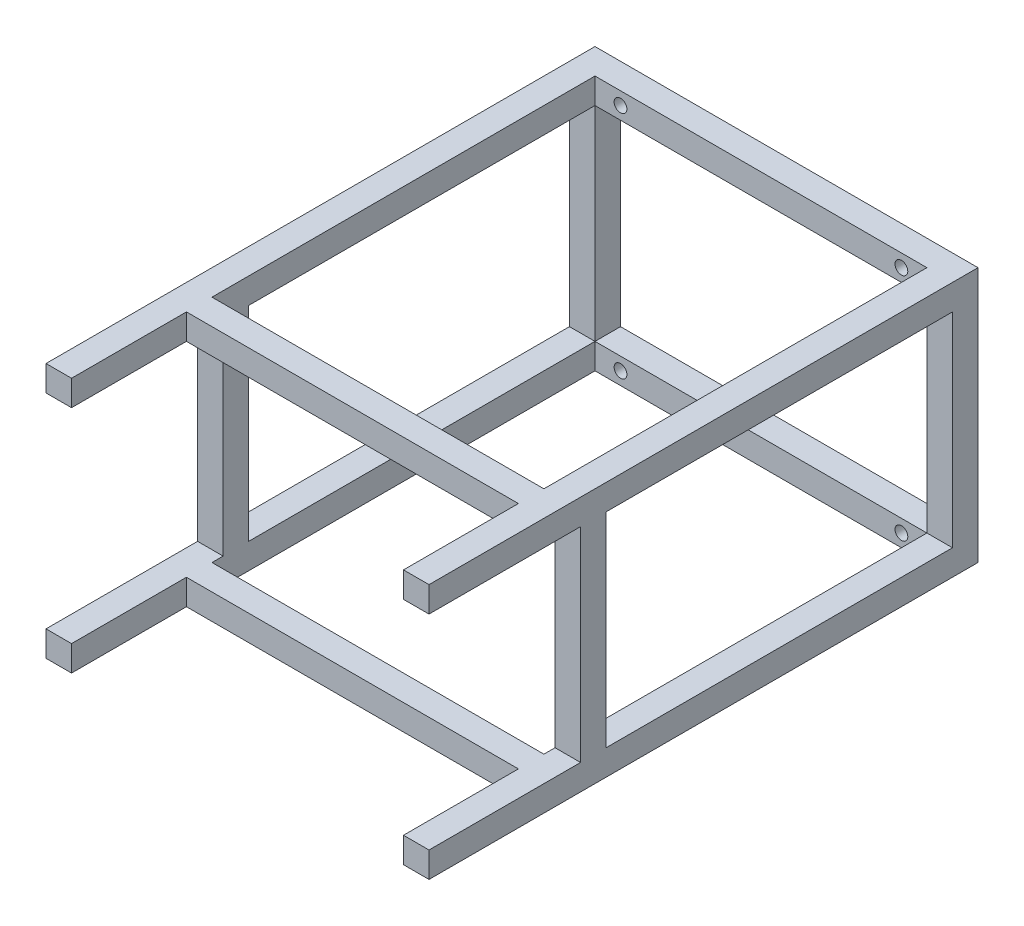
from build123d import *

# Parameters (mm, degrees)
SKETCH_1_W          = 20
SKETCH_1_H          = 20
EXTRUDE_1_DEPTH     = 430
EXTRUDE_1_2_DEPTH   = 430
EXTRUDE_1_3_DEPTH   = 430
EXTRUDE_1_4_DEPTH   = 430
SKETCH_2_W          = 20
SKETCH_2_H          = 20
EXTRUDE_2_DEPTH     = 260
SKETCH_3_W          = 20
SKETCH_3_H          = 20
EXTRUDE_3_DEPTH     = 160
SKETCH_5_W          = 20
SKETCH_5_H          = 20
EXTRUDE_4_DEPTH     = 261
SKETCH_6_W          = 20
SKETCH_6_H          = 20
EXTRUDE_6_DEPTH     = 160
SKETCH_7_R          = 5
CUT_EXTRUDE_2_DEPTH = 41


with BuildPart() as part:
    # 草图1 → 凸台-拉伸1 (new body)
    with BuildSketch(Plane.XY):
        with Locations((-140, 90)):
            Rectangle(SKETCH_1_W, SKETCH_1_H)
    extrude(amount=EXTRUDE_1_DEPTH)



with BuildPart() as body_2:
    # 草图1 → Extrude 1 2 (new body)
    with BuildSketch(Plane.XY):
        with Locations((-140, -90)):
            Rectangle(SKETCH_1_W, SKETCH_1_H)
    extrude(amount=EXTRUDE_1_2_DEPTH)


with BuildPart() as body_3:
    # 草图1 → Extrude 1 3 (new body)
    with BuildSketch(Plane.XY):
        with Locations((140, -90)):
            Rectangle(SKETCH_1_W, SKETCH_1_H)
    extrude(amount=EXTRUDE_1_3_DEPTH)


with BuildPart() as body_4:
    # 草图1 → Extrude 1 4 (new body)
    with BuildSketch(Plane.XY):
        with Locations((140, 90)):
            Rectangle(SKETCH_1_W, SKETCH_1_H)
    extrude(amount=EXTRUDE_1_4_DEPTH)


with BuildPart() as part_1:
    add(part.part)

    add(body_2.part)  # 凸台-拉伸2 merges body 2

    add(body_3.part)  # 凸台-拉伸2 merges body 3

    add(body_4.part)  # 凸台-拉伸2 merges body 4
    # 草图2 → 凸台-拉伸2 (add)
    with BuildSketch(Plane(origin=(-130, 0, 0), x_dir=(0, 0, -1), z_dir=(1, 0, 0))):
        with Locations((-10, 90)):
            Rectangle(SKETCH_2_W, SKETCH_2_H)
        with Locations((-10, -90)):
            Rectangle(SKETCH_2_W, SKETCH_2_H)
    extrude(amount=EXTRUDE_2_DEPTH)

    # 草图3 → 凸台-拉伸3 (add)
    with BuildSketch(Plane(origin=(0, -80, 0), x_dir=(1, 0, 0), z_dir=(0, 1, 0))):
        with Locations((140, -10)):
            Rectangle(SKETCH_3_W, SKETCH_3_H)
        with Locations((-140, -10)):
            Rectangle(SKETCH_3_W, SKETCH_3_H)
    extrude(amount=EXTRUDE_3_DEPTH)

    # 草图5 → 凸台-拉伸4 (add)
    with BuildSketch(Plane(origin=(-130, 0, 0), x_dir=(0, 0, -1), z_dir=(1, 0, 0))):
        with Locations((-330, 90)):
            Rectangle(SKETCH_5_W, SKETCH_5_H)
        with Locations((-330, -90)):
            Rectangle(SKETCH_5_W, SKETCH_5_H)
    extrude(amount=EXTRUDE_4_DEPTH)

    # 草图6 → 凸台-拉伸6 (add)
    with BuildSketch(Plane.XZ.offset(-80)):
        with Locations((140, 301.284847627)):
            Rectangle(SKETCH_6_W, SKETCH_6_H)
        with Locations((-140, 301.284847627)):
            Rectangle(SKETCH_6_W, SKETCH_6_H)
    extrude(amount=EXTRUDE_6_DEPTH)

    # 草图7 → 切除-拉伸2 (cut)
    with BuildSketch(Plane.XY.offset(20)):
        with Locations((110, 90)):
            Circle(SKETCH_7_R)
        with Locations((110, -90)):
            Circle(SKETCH_7_R)
        with Locations((-110, -90)):
            Circle(SKETCH_7_R)
        with Locations((-110, 90)):
            Circle(SKETCH_7_R)
    extrude(amount=-CUT_EXTRUDE_2_DEPTH, mode=Mode.SUBTRACT)


solid = part_1.part
